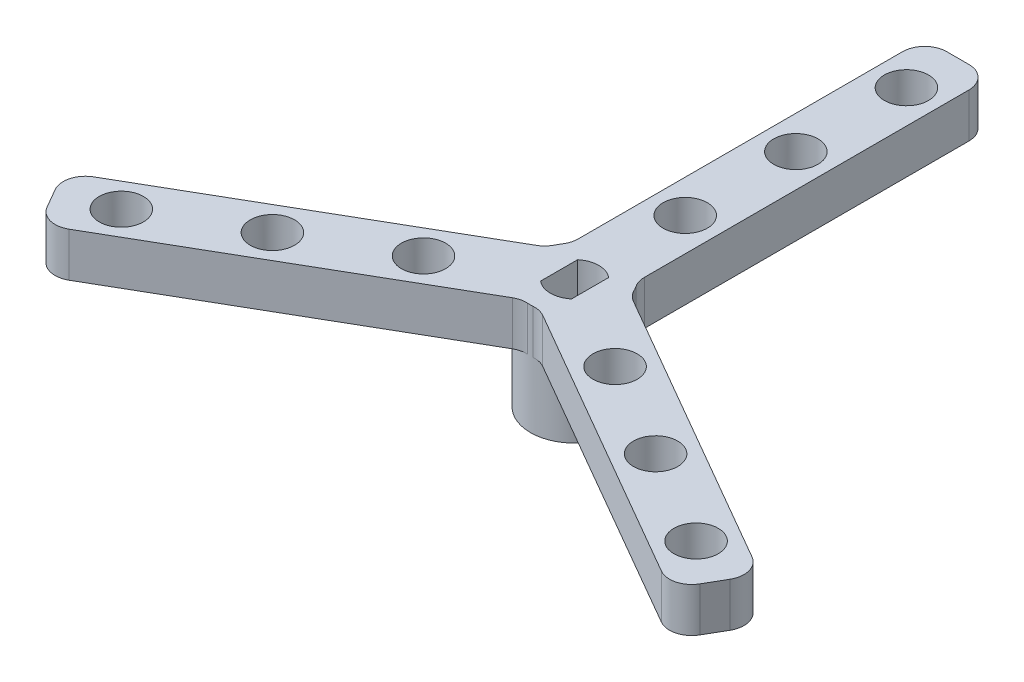
from build123d import *

# Parameters (mm, degrees)
SKETCH1_R           = 5
BOSS_EXTRUDE1_DEPTH = 12.5
SKETCH2_W           = 7.5
SKETCH2_H           = 40
BOSS_EXTRUDE4_DEPTH = 5
SKETCH4_R           = 2.5
CUT_EXTRUDE1_DEPTH  = 100
FILLET1_R           = 2.5
FILLET2_R           = 2.5


with BuildPart() as part:
    # Sketch1 → Boss-Extrude1 (new body)
    with BuildSketch(Plane(origin=(0, 0, 0), x_dir=(1, 0, 0), z_dir=(0, 1, 0))):
        with Locations(Location((0.037460471, 3.715413796, 0), (0, 0, 270))):
            Circle(SKETCH1_R)
        with BuildLine():
            ThreePointArc((-1.712539529, 1.62008566), (0.037460471, 0.985413796), (1.787460471, 1.62008566))
            Line((1.787460471, 1.62008566), (1.787460471, 5.811378349))
            ThreePointArc((1.787460471, 5.811378349), (0.037460471, 6.446050212), (-1.712539529, 5.811378349))
            Line((-1.712539529, 5.811378349), (-1.712539529, 1.62008566))
        make_face(mode=Mode.SUBTRACT)
    extrude(amount=BOSS_EXTRUDE1_DEPTH)

    # Sketch2 → Boss-Extrude4 (add)
    with BuildSketch(Plane(origin=(0, 12.5, 0), x_dir=(1, 0, 0), z_dir=(0, 1, 0))):
        Polygon((4.77657028, 5.309414491), (1.02657028, -1.185776038), (35.667586431, -21.185776038), (39.417586431, -14.690585509), align=None)
        with Locations((0.037460471, 27.022602935)):
            Rectangle(SKETCH2_W, SKETCH2_H)
        Polygon((-4.701649339, 5.309414491), (-0.951649339, -1.185776038), (-35.59266549, -21.185776038), (-39.34266549, -14.690585509), align=None)
    extrude(amount=-BOSS_EXTRUDE4_DEPTH)

    # Sketch4 → Cut-Extrude1 (cut)
    with BuildSketch(Plane(origin=(0, 12.5, 0), x_dir=(1, 0, 0), z_dir=(0, 1, 0))):
        with Locations(Location((0.037460471, 16.216050212, 0), (0, 0, 270))):
            Circle(SKETCH4_R)
        with Locations(Location((0.037460471, 28.716050212, 0), (0, 0, 270))):
            Circle(SKETCH4_R)
        with Locations(Location((0.037460471, 41.216050212, 0), (0, 0, 270))):
            Circle(SKETCH4_R)
        with Locations(Location((-10.788016154, -2.533674249, 0), (0, 0, 270))):
            Circle(SKETCH4_R)
        with Locations(Location((-21.613492779, -8.78339871, 0), (0, 0, 270))):
            Circle(SKETCH4_R)
        with Locations(Location((-32.438969404, -15.033123172, 0), (0, 0, 270))):
            Circle(SKETCH4_R)
        with Locations(Location((10.862937095, -2.533674249, 0), (0, 0, 90))):
            Circle(SKETCH4_R)
        with Locations(Location((21.68841372, -8.78339871, 0), (0, 0, 90))):
            Circle(SKETCH4_R)
        with Locations(Location((32.513890345, -15.033123172, 0), (0, 0, 90))):
            Circle(SKETCH4_R)
    extrude(amount=-CUT_EXTRUDE1_DEPTH, mode=Mode.SUBTRACT)

    # Fillet1
    fillet1_edges = [part.edges().sort_by_distance(p)[0] for p in [
        (4.77657028, 10, -5.309414491),
        (1.02657028, 10, 1.185776038),
        (-3.712539529, 10, -7.022602935),
        (3.787460471, 10, -7.022602935),
        (-4.701649339, 10, -5.309414491),
        (-0.951649339, 10, 1.185776038),
    ]]
    fillet(fillet1_edges, radius=FILLET1_R)

    # Fillet2
    fillet2_edges = [part.edges().sort_by_distance(p)[0] for p in [
        (39.417586431, 10, 14.690585509),
        (35.667586431, 10, 21.185776038),
        (-3.712539529, 10, -47.022602935),
        (3.787460471, 10, -47.022602935),
        (-39.34266549, 10, 14.690585509),
        (-35.59266549, 10, 21.185776038),
    ]]
    fillet(fillet2_edges, radius=FILLET2_R)


solid = part.part
